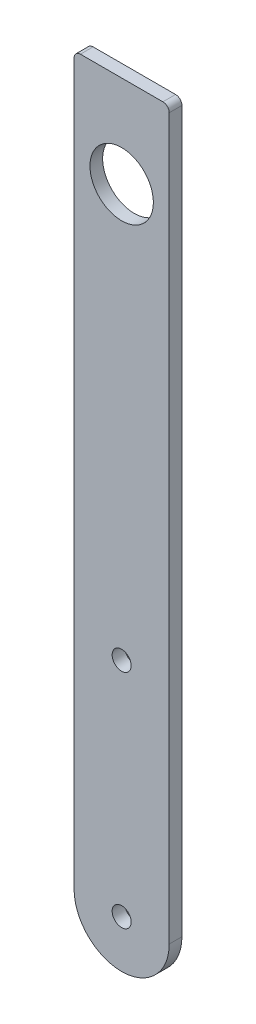
from build123d import *

# Parameters (mm, degrees)
BOSS_EXTRUDE2_DEPTH = 2
CUT_EXTRUDE1_DEPTH  = 2
FILLET1_R           = 1


with BuildPart() as part:
    # Sketch2 → Boss-Extrude2 (new body)
    with BuildSketch(Plane.XY):
        with BuildLine():
            Line((0, 100), (0, 6.5))
            ThreePointArc((0, 6.5), (7.5, -1), (15, 6.5))
            Line((15, 6.5), (15, 100))
            Line((15, 100), (15, 121))
            Line((15, 121), (7.5, 121))
            Line((7.5, 121), (0, 121))
            Line((0, 121), (0, 100))
        make_face()
        with BuildLine():
            ThreePointArc((9, 6.5), (6.439339828, 5.439339828), (7.5, 8))
            ThreePointArc((7.5, 8), (8.560660172, 7.560660172), (9, 6.5))
        make_face(mode=Mode.SUBTRACT)
        with BuildLine():
            ThreePointArc((12.5, 106.5), (11.035533906, 102.964466094), (7.5, 101.5))
            ThreePointArc((7.5, 101.5), (3.964466094, 110.035533906), (12.5, 106.5))
        make_face(mode=Mode.SUBTRACT)
    extrude(amount=BOSS_EXTRUDE2_DEPTH)

    # Sketch3 → Cut-Extrude1 (cut)
    with BuildSketch(Plane.XY.offset(2)):
        with BuildLine():
            ThreePointArc((7.5, 43), (6.439339828, 40.439339828), (9, 41.5))
            ThreePointArc((9, 41.5), (8.560660172, 42.560660172), (7.5, 43))
        make_face()
    extrude(amount=-CUT_EXTRUDE1_DEPTH, mode=Mode.SUBTRACT)

    # Fillet1
    fillet1_edges = [part.edges().sort_by_distance(p)[0] for p in [
        (15, 121, 1),
        (0, 121, 1),
    ]]
    fillet(fillet1_edges, radius=FILLET1_R)


solid = part.part
